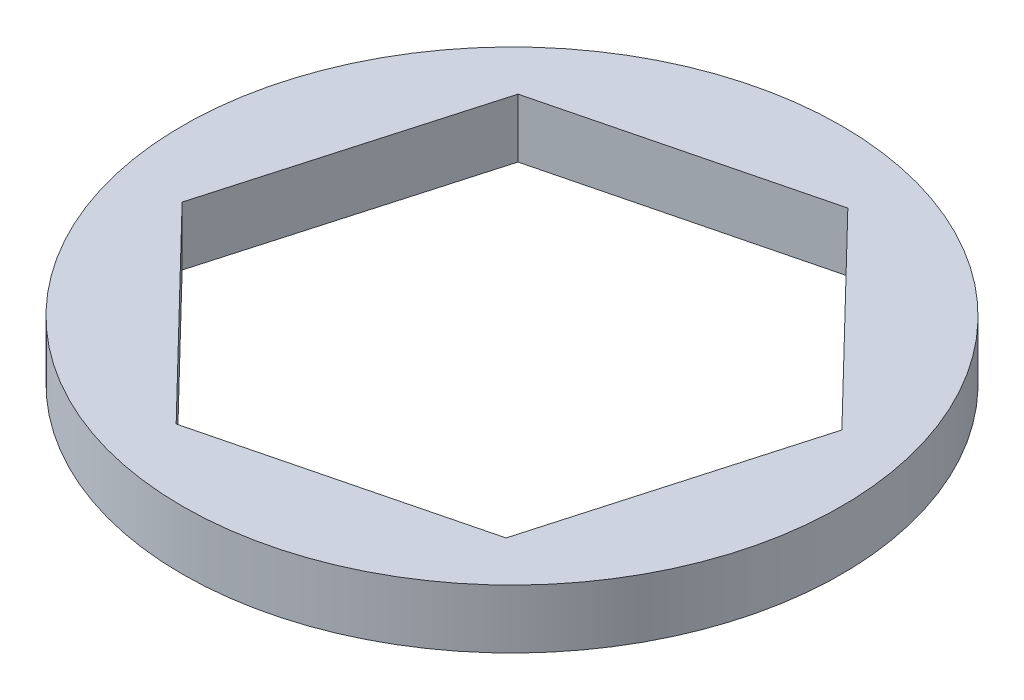
from build123d import *

# Parameters (mm, degrees)
SKETCH1_R           = 8.89
BOSS_EXTRUDE1_DEPTH = 1.5875


with BuildPart() as part:
    # Sketch1 → Boss-Extrude1 (new body)
    with BuildSketch(Plane(origin=(0, 0, 0), x_dir=(1, 0, 0), z_dir=(0, 1, 0))):
        with Locations(Location((0, 0, 0), (0, 0, 270))):
            Circle(SKETCH1_R)
        Polygon((2.007551417, 7.052167797), (-5.103580756, 5.264674425), (-7.111132173, -1.787493372), (-2.007551417, -7.052167797), (5.103580756, -5.264674425), (7.111132173, 1.787493372), align=None, mode=Mode.SUBTRACT)
    extrude(amount=BOSS_EXTRUDE1_DEPTH)


solid = part.part
